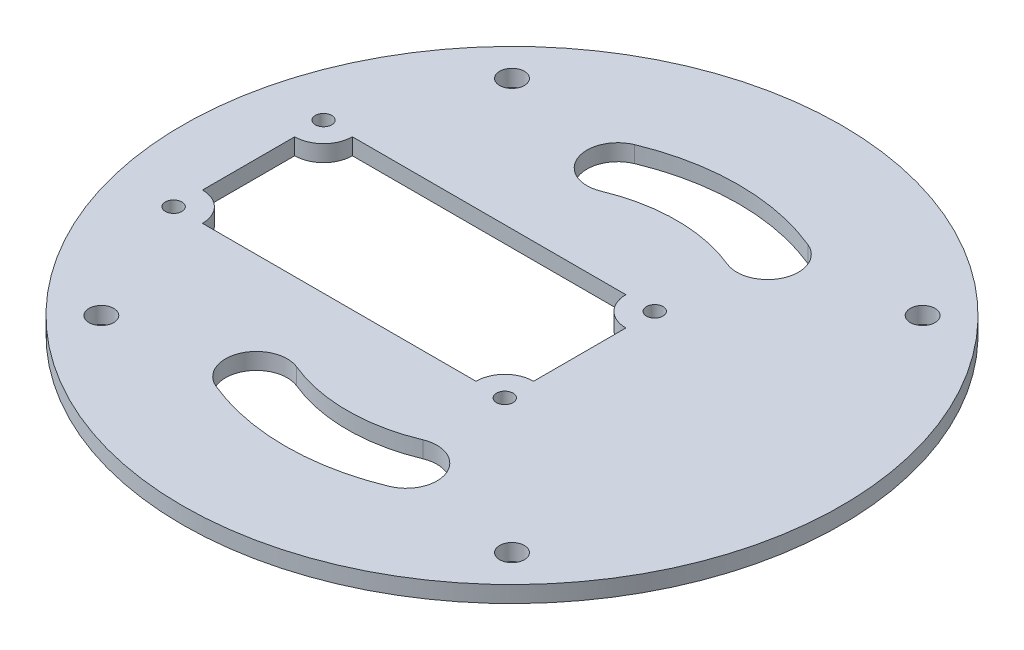
from build123d import *

# Parameters (mm, degrees)
CROQUIS2_R              = 40.005937341
CROQUIS2_R_2            = 0.995391995
CROQUIS2_R_3            = 1.004055524
CROQUIS2_R_4            = 1.00622676
CROQUIS2_R_5            = 1.004640813
CROQUIS2_R_6            = 1.5
SALIENTE_EXTRUIR1_DEPTH = 2


with BuildPart() as part:
    # Croquis2 → Saliente-Extruir1 (new body)
    with BuildSketch(Plane(origin=(0, 0, 0), x_dir=(1, 0, 0), z_dir=(0, 1, 0))):
        with Locations(Location((0, 0, 0), (0, 0, 270))):
            Circle(CROQUIS2_R)
        with Locations(Location((-31.9766, 9.1, 0), (0, 0, 270))):
            Circle(CROQUIS2_R_2, mode=Mode.SUBTRACT)
        with Locations(Location((-31.9766, -9.1, 0), (0, 0, 270))):
            Circle(CROQUIS2_R_3, mode=Mode.SUBTRACT)
        with Locations(Location((8.2234, 9.1, 0), (0, 0, 270))):
            Circle(CROQUIS2_R_4, mode=Mode.SUBTRACT)
        with Locations(Location((8.2234, -9.1, 0), (0, 0, 270))):
            Circle(CROQUIS2_R_5, mode=Mode.SUBTRACT)
        with Locations(Location((-24.925514037, 24.925514037, 0), (0, 0, 270))):
            Circle(CROQUIS2_R_6, mode=Mode.SUBTRACT)
        with Locations(Location((24.925514037, 24.925514037, 0), (0, 0, 270))):
            Circle(CROQUIS2_R_6, mode=Mode.SUBTRACT)
        with Locations(Location((24.925514037, -24.925514037, 0), (0, 0, 270))):
            Circle(CROQUIS2_R_6, mode=Mode.SUBTRACT)
        with Locations(Location((-24.925514037, -24.925514037, 0), (0, 0, 270))):
            Circle(CROQUIS2_R_6, mode=Mode.SUBTRACT)
        with BuildLine():
            Line((-28.4766, -9.1), (4.7234, -9.1))
            ThreePointArc((4.7234, -9.1), (5.748526266, -6.625126266), (8.2234, -5.6))
            Line((8.2234, -5.6), (8.2234, 5.6))
            ThreePointArc((8.2234, 5.6), (5.748526266, 6.625126266), (4.7234, 9.1))
            Line((4.7234, 9.1), (-28.4766, 9.1))
            ThreePointArc((-28.4766, 9.1), (-29.501726266, 6.625126266), (-31.9766, 5.6))
            Line((-31.9766, 5.6), (-31.9766, -5.6))
            ThreePointArc((-31.9766, -5.6), (-29.501726266, -6.625126266), (-28.4766, -9.1))
        make_face(mode=Mode.SUBTRACT)
        with BuildLine():
            ThreePointArc((-7.653668647, -18.47759065), (0, -20), (7.653668647, -18.47759065))
            ThreePointArc((7.653668647, -18.47759065), (12.553279766, -20.507076026), (10.52379439, -25.406687144))
            ThreePointArc((10.52379439, -25.406687144), (0, -27.5), (-10.52379439, -25.406687144))
            ThreePointArc((-10.52379439, -25.406687144), (-12.553279766, -20.507076026), (-7.653668647, -18.47759065))
        make_face(mode=Mode.SUBTRACT)
        with BuildLine():
            ThreePointArc((-10.52379439, 25.406687144), (-12.553279766, 20.507076026), (-7.653668647, 18.47759065))
            ThreePointArc((-7.653668647, 18.47759065), (0, 20), (7.653668647, 18.47759065))
            ThreePointArc((7.653668647, 18.47759065), (12.553279766, 20.507076026), (10.52379439, 25.406687144))
            ThreePointArc((10.52379439, 25.406687144), (0, 27.5), (-10.52379439, 25.406687144))
        make_face(mode=Mode.SUBTRACT)
    extrude(amount=SALIENTE_EXTRUIR1_DEPTH)


solid = part.part
